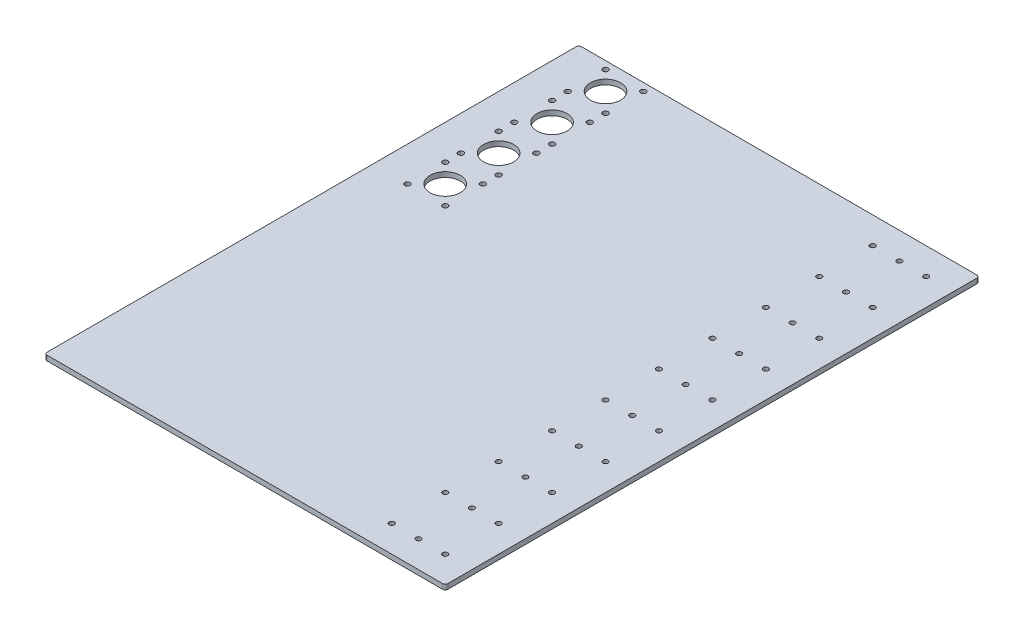
from build123d import *

# Parameters (mm, degrees)
SKETCH1_W           = 381
SKETCH1_H           = 508
BOSS_EXTRUDE1_DEPTH = 4.7625
SKETCH2_R           = 14.3383
SKETCH2_R_2         = 2.54
CUT_EXTRUDE1_DEPTH  = 4.7625
SKETCH3_R           = 2.413
CUT_EXTRUDE2_DEPTH  = 4.7625
FILLET1_R           = 2.54


with BuildPart() as part:
    # Sketch1 → Boss-Extrude1 (new body)
    with BuildSketch(Plane(origin=(0, 0, 0), x_dir=(1, 0, 0), z_dir=(0, 1, 0))):
        Rectangle(SKETCH1_W, SKETCH1_H)
    extrude(amount=BOSS_EXTRUDE1_DEPTH)

    # Sketch2 → Cut-Extrude1 (cut)
    with BuildSketch(Plane(origin=(0, 4.7625, 0), x_dir=(1, 0, 0), z_dir=(0, 1, 0))):
        with Locations(Location((-139.7, 228.6, 0), (0, 0, 270))):
            Circle(SKETCH2_R)
        with Locations(Location((-157.660512242, 246.560512242, 0), (0, 0, 270))):
            Circle(SKETCH2_R_2)
        with Locations(Location((-121.739487758, 246.560512242, 0), (0, 0, 270))):
            Circle(SKETCH2_R_2)
        with Locations(Location((-121.739487758, 210.639487758, 0), (0, 0, 270))):
            Circle(SKETCH2_R_2)
        with Locations(Location((-157.660512242, 210.639487758, 0), (0, 0, 270))):
            Circle(SKETCH2_R_2)
        with Locations(Location((-139.7, 177.8, 0), (0, 0, 270))):
            Circle(SKETCH2_R)
        with Locations(Location((-121.739487758, 195.760512242, 0), (0, 0, 270))):
            Circle(SKETCH2_R_2)
        with Locations(Location((-157.660512242, 195.760512242, 0), (0, 0, 270))):
            Circle(SKETCH2_R_2)
        with Locations(Location((-157.660512242, 159.839487758, 0), (0, 0, 270))):
            Circle(SKETCH2_R_2)
        with Locations(Location((-121.739487758, 159.839487758, 0), (0, 0, 270))):
            Circle(SKETCH2_R_2)
        with Locations(Location((-139.7, 127, 0), (0, 0, 270))):
            Circle(SKETCH2_R)
        with Locations(Location((-121.739487758, 144.960512242, 0), (0, 0, 270))):
            Circle(SKETCH2_R_2)
        with Locations(Location((-157.660512242, 144.960512242, 0), (0, 0, 270))):
            Circle(SKETCH2_R_2)
        with Locations(Location((-157.660512242, 109.039487758, 0), (0, 0, 270))):
            Circle(SKETCH2_R_2)
        with Locations(Location((-121.739487758, 109.039487758, 0), (0, 0, 270))):
            Circle(SKETCH2_R_2)
        with Locations(Location((-139.7, 76.2, 0), (0, 0, 270))):
            Circle(SKETCH2_R)
        with Locations(Location((-121.739487758, 94.160512242, 0), (0, 0, 270))):
            Circle(SKETCH2_R_2)
        with Locations(Location((-157.660512242, 94.160512242, 0), (0, 0, 270))):
            Circle(SKETCH2_R_2)
        with Locations(Location((-157.660512242, 58.239487758, 0), (0, 0, 270))):
            Circle(SKETCH2_R_2)
        with Locations(Location((-121.739487758, 58.239487758, 0), (0, 0, 270))):
            Circle(SKETCH2_R_2)
    extrude(amount=-CUT_EXTRUDE1_DEPTH, mode=Mode.SUBTRACT)

    # Sketch3 → Cut-Extrude2 (cut)
    with BuildSketch(Plane(origin=(0, 4.7625, 0), x_dir=(1, 0, 0), z_dir=(0, 1, 0))):
        with Locations(Location((165.1, 228.6, 0), (0, 0, 270))):
            Circle(SKETCH3_R)
        with Locations(Location((165.1, 177.8, 0), (0, 0, 270))):
            Circle(SKETCH3_R)
        with Locations(Location((165.1, 127, 0), (0, 0, 270))):
            Circle(SKETCH3_R)
        with Locations(Location((165.1, 76.2, 0), (0, 0, 270))):
            Circle(SKETCH3_R)
        with Locations(Location((165.1, 25.4, 0), (0, 0, 270))):
            Circle(SKETCH3_R)
        with Locations(Location((165.1, -25.4, 0), (0, 0, 270))):
            Circle(SKETCH3_R)
        with Locations(Location((165.1, -76.2, 0), (0, 0, 270))):
            Circle(SKETCH3_R)
        with Locations(Location((165.1, -127, 0), (0, 0, 270))):
            Circle(SKETCH3_R)
        with Locations(Location((165.1, -177.8, 0), (0, 0, 270))):
            Circle(SKETCH3_R)
        with Locations(Location((165.1, -228.6, 0), (0, 0, 270))):
            Circle(SKETCH3_R)
        with Locations(Location((139.7, 177.8, 0), (0, 0, 270))):
            Circle(SKETCH3_R)
        with Locations(Location((139.7, 127, 0), (0, 0, 270))):
            Circle(SKETCH3_R)
        with Locations(Location((139.7, 76.2, 0), (0, 0, 270))):
            Circle(SKETCH3_R)
        with Locations(Location((139.7, 25.4, 0), (0, 0, 270))):
            Circle(SKETCH3_R)
        with Locations(Location((139.7, -25.4, 0), (0, 0, 270))):
            Circle(SKETCH3_R)
        with Locations(Location((139.7, -76.2, 0), (0, 0, 270))):
            Circle(SKETCH3_R)
        with Locations(Location((139.7, -127, 0), (0, 0, 270))):
            Circle(SKETCH3_R)
        with Locations(Location((139.7, -177.8, 0), (0, 0, 270))):
            Circle(SKETCH3_R)
        with Locations(Location((139.7, -228.6, 0), (0, 0, 270))):
            Circle(SKETCH3_R)
        with Locations(Location((114.3, 177.8, 0), (0, 0, 270))):
            Circle(SKETCH3_R)
        with Locations(Location((114.3, 127, 0), (0, 0, 270))):
            Circle(SKETCH3_R)
        with Locations(Location((114.3, 76.2, 0), (0, 0, 270))):
            Circle(SKETCH3_R)
        with Locations(Location((114.3, 25.4, 0), (0, 0, 270))):
            Circle(SKETCH3_R)
        with Locations(Location((114.3, -25.4, 0), (0, 0, 270))):
            Circle(SKETCH3_R)
        with Locations(Location((114.3, -76.2, 0), (0, 0, 270))):
            Circle(SKETCH3_R)
        with Locations(Location((114.3, -127, 0), (0, 0, 270))):
            Circle(SKETCH3_R)
        with Locations(Location((114.3, -177.8, 0), (0, 0, 270))):
            Circle(SKETCH3_R)
        with Locations(Location((114.3, -228.6, 0), (0, 0, 270))):
            Circle(SKETCH3_R)
        with Locations(Location((139.7, 228.6, 0), (0, 0, 270))):
            Circle(SKETCH3_R)
        with Locations(Location((114.3, 228.6, 0), (0, 0, 270))):
            Circle(SKETCH3_R)
    extrude(amount=-CUT_EXTRUDE2_DEPTH, mode=Mode.SUBTRACT)

    # Fillet1
    fillet1_edges = [part.edges().sort_by_distance(p)[0] for p in [
        (190.5, 2.38125, 254),
        (-190.5, 2.38125, 254),
        (-190.5, 2.38125, -254),
        (190.5, 2.38125, -254),
    ]]
    fillet(fillet1_edges, radius=FILLET1_R)


solid = part.part
